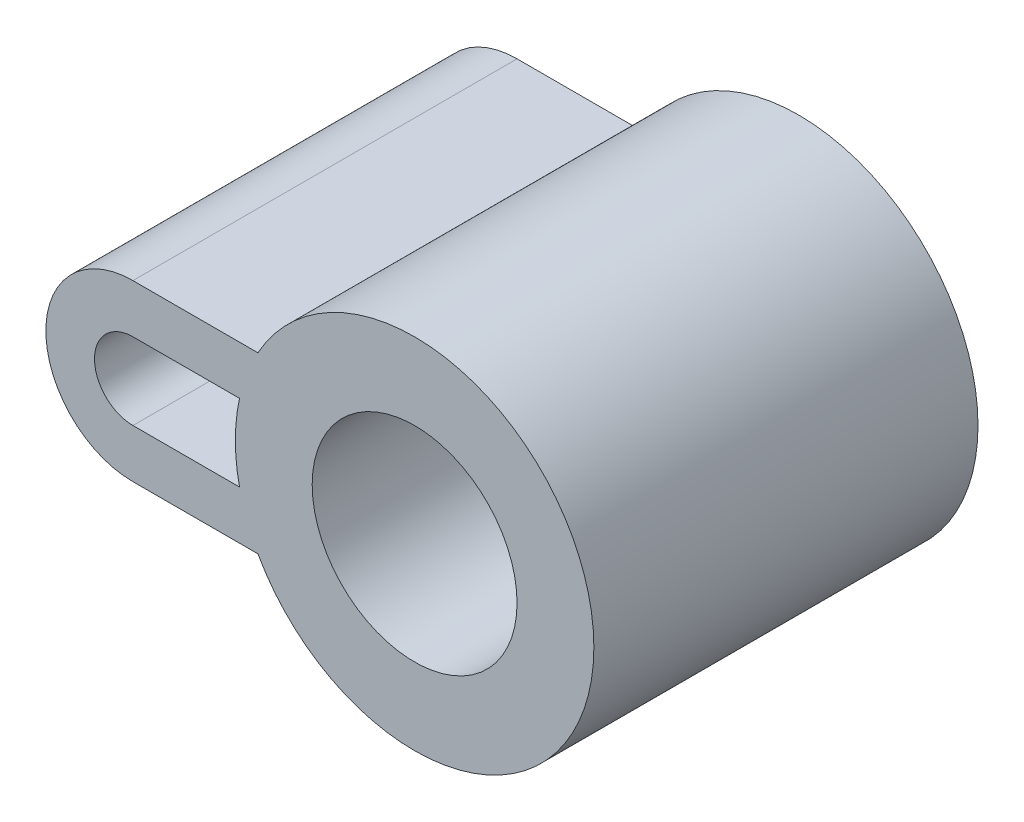
from build123d import *

# Parameters (mm, degrees)
SKETCH1_R           = 35
SKETCH1_R_2         = 20
BOSS_EXTRUDE1_DEPTH = 75


with BuildPart() as part:
    # Sketch1 → Boss-Extrude1 (new body)
    # profile 1 of 2: a face of its own
    with BuildSketch(Plane.XY):
        Circle(SKETCH1_R)
        Circle(SKETCH1_R_2, mode=Mode.SUBTRACT)
    # profile 2 of 2: a face of its own
    with BuildSketch(Plane.XY):
        with BuildLine():
            ThreePointArc((-34.186985828, 7.5), (-32.736987087, 12.381020816), (-30.594117082, 17))
            Line((-30.594117082, 17), (-55, 17))
            ThreePointArc((-55, 17), (-72, 0), (-55, -17))
            Line((-55, -17), (-30.594117082, -17))
            ThreePointArc((-30.594117082, -17), (-32.736987087, -12.381020816), (-34.186985828, -7.5))
            Line((-34.186985828, -7.5), (-55, -7.5))
            ThreePointArc((-55, -7.5), (-62.5, 0), (-55, 7.5))
            Line((-55, 7.5), (-34.186985828, 7.5))
        make_face()
    extrude(amount=BOSS_EXTRUDE1_DEPTH)


solid = part.part
